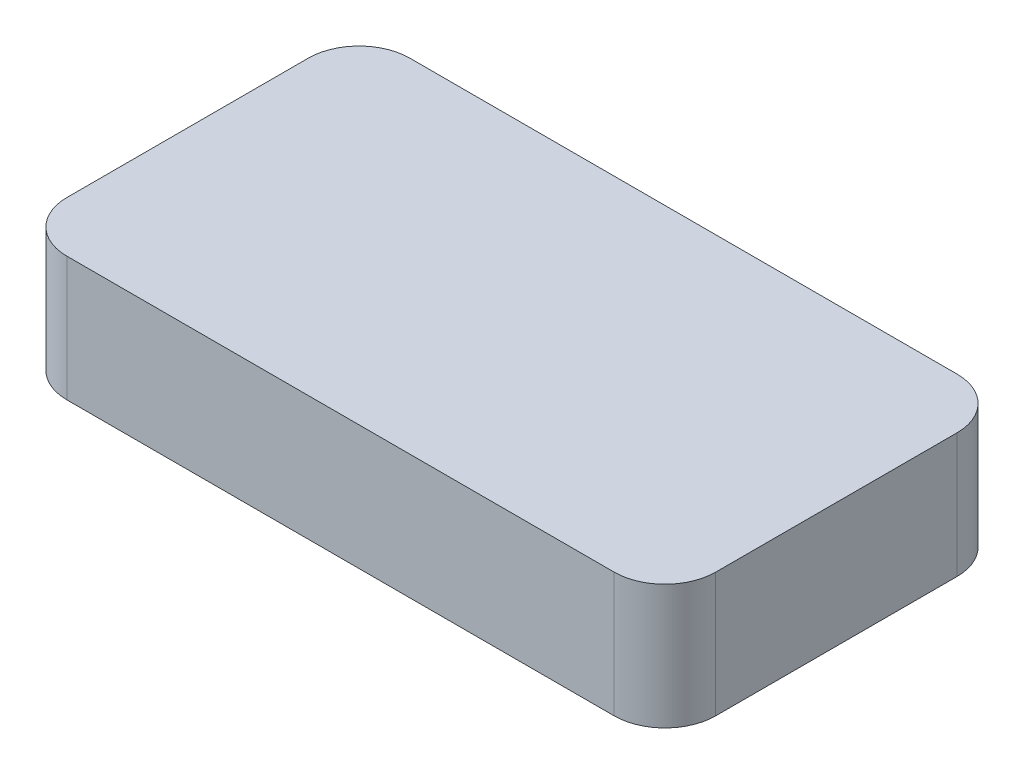
from build123d import *

# Parameters (mm, degrees)
SKETCH1_W           = 32.4358
SKETCH1_H           = 17.145
BOSS_EXTRUDE1_DEPTH = 6.223
FILLET1_R           = 2.54


with BuildPart() as part:
    # Sketch1 → Boss-Extrude1 (new body)
    with BuildSketch(Plane(origin=(0, 0, 0), x_dir=(1, 0, 0), z_dir=(0, 1, 0))):
        with Locations((16.2179, 8.5725)):
            Rectangle(SKETCH1_W, SKETCH1_H)
    extrude(amount=BOSS_EXTRUDE1_DEPTH)

    # Fillet1
    fillet1_edges = [part.edges().sort_by_distance(p)[0] for p in [
        (0, 3.1115, -17.145),
        (32.4358, 3.1115, -17.145),
        (32.4358, 3.1115, 0),
        (0, 3.1115, 0),
    ]]
    fillet(fillet1_edges, radius=FILLET1_R)


solid = part.part
